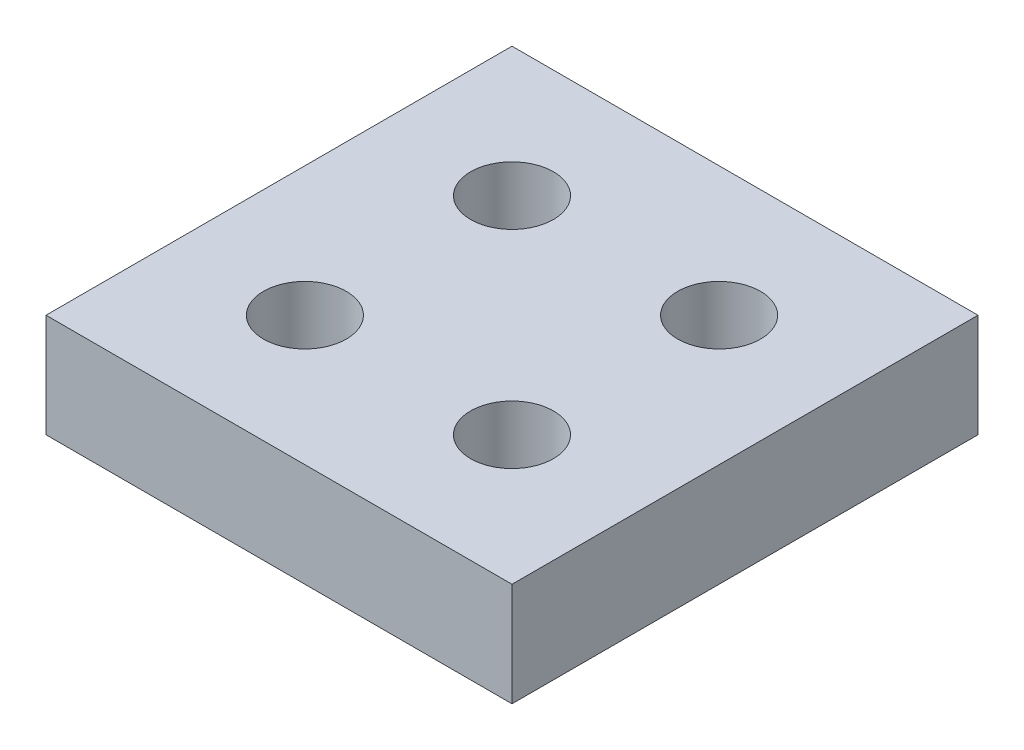
from build123d import *

# Parameters (mm, degrees)
SKETCH_1_W      = 4.5
SKETCH_1_H      = 4.5
SKETCH_1_R      = 0.4
EXTRUDE_1_DEPTH = 1


with BuildPart() as part:
    # 草图1 → 凸台-拉伸1 (new body)
    with BuildSketch(Plane(origin=(0, 0, 0), x_dir=(1, 0, 0), z_dir=(0, 1, 0))):
        Rectangle(SKETCH_1_W, SKETCH_1_H)
        with Locations(Location((-1, 1, 0), (0, 0, 270))):
            Circle(SKETCH_1_R, mode=Mode.SUBTRACT)
        with Locations(Location((1, 1, 0), (0, 0, 270))):
            Circle(SKETCH_1_R, mode=Mode.SUBTRACT)
        with Locations(Location((1, -1, 0), (0, 0, 270))):
            Circle(SKETCH_1_R, mode=Mode.SUBTRACT)
        with Locations(Location((-1, -1, 0), (0, 0, 270))):
            Circle(SKETCH_1_R, mode=Mode.SUBTRACT)
    extrude(amount=EXTRUDE_1_DEPTH)


solid = part.part
